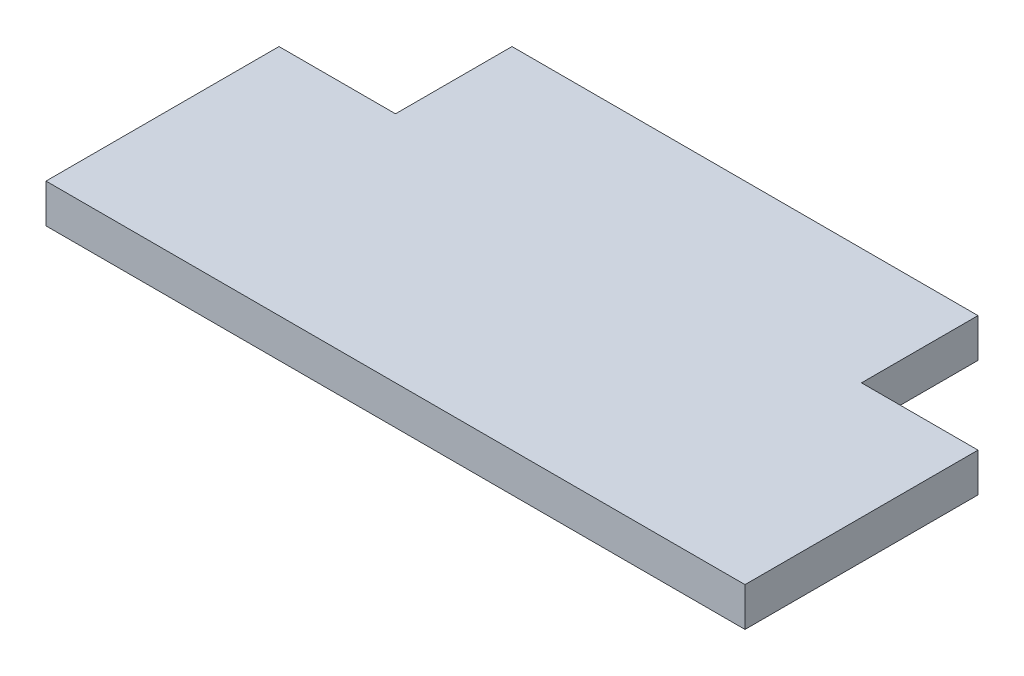
from build123d import *

# Parameters (mm, degrees)
SKETCH1_W           = 1828.8
SKETCH1_H           = 609.6
SKETCH1_W_2         = 1219.2
SKETCH1_H_2         = 304.8
BOSS_EXTRUDE1_DEPTH = 101.6


with BuildPart() as part:
    # Sketch1 → Boss-Extrude1 (new body)
    with BuildSketch(Plane(origin=(0, 0, 0), x_dir=(1, 0, 0), z_dir=(0, 1, 0))):
        Rectangle(SKETCH1_W, SKETCH1_H)
        with Locations((0, 457.2)):
            Rectangle(SKETCH1_W_2, SKETCH1_H_2)
    extrude(amount=BOSS_EXTRUDE1_DEPTH)


solid = part.part
